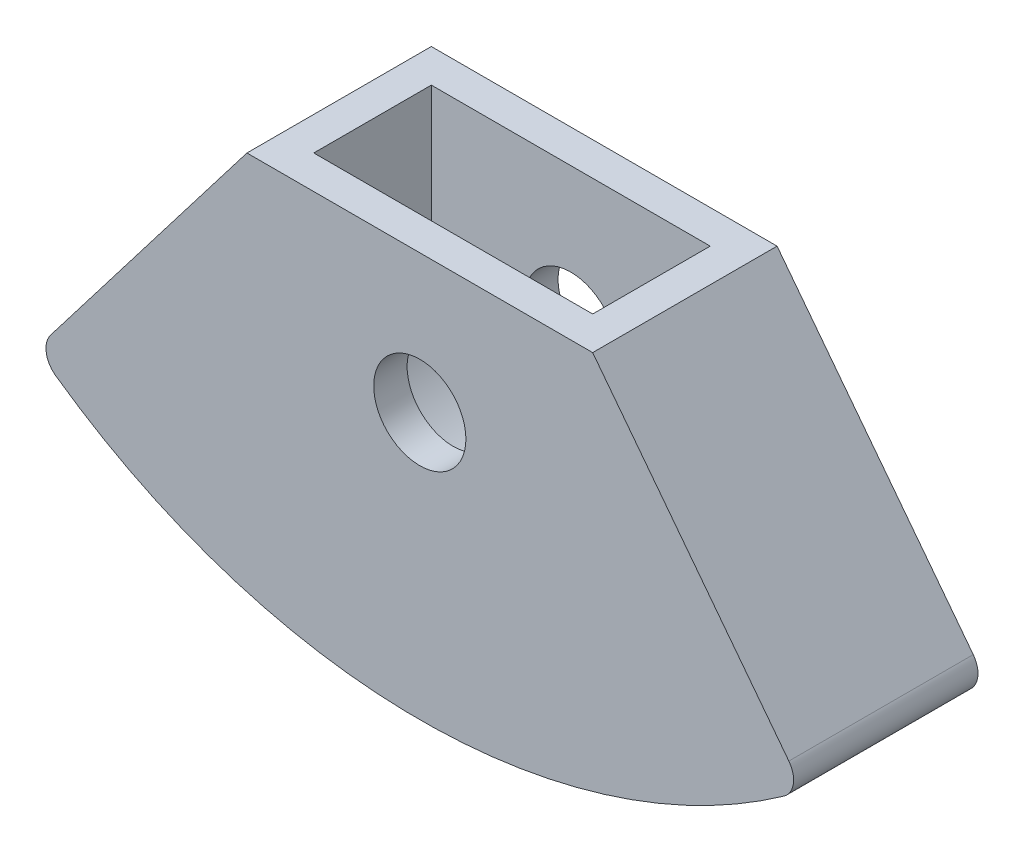
from build123d import *

# Parameters (mm, degrees)
EXTRUDE_1_DEPTH     = 4
CUT_EXTRUDE_1_DEPTH = 2.55
SKETCH_3_R          = 2
CUT_EXTRUDE_2_DEPTH = 31.567792564


with BuildPart() as part:
    # 草图1 → 凸台-拉伸1 (new, symmetric)
    with BuildSketch(Plane.XY):
        with BuildLine():
            Line((0, 0), (15, 0))
            Line((15, 0), (23.511091256, -11.091870075))
            ThreePointArc((23.511091256, -11.091870075), (23.706523759, -11.849971903), (23.295917311, -12.516541172))
            ThreePointArc((23.295917311, -12.516541172), (7.5, -17.545906941), (-8.295917311, -12.516541172))
            ThreePointArc((-8.295917311, -12.516541172), (-8.706523759, -11.849971903), (-8.511091256, -11.091870075))
            Line((-8.511091256, -11.091870075), (0, 0))
        make_face()
    extrude(amount=EXTRUDE_1_DEPTH, both=True)

    # 草图2 → 切除-拉伸1 (cut, symmetric)
    with BuildSketch(Plane.XY):
        with BuildLine():
            Line((1.45, 0), (1.45, -6))
            ThreePointArc((1.45, -6), (7.5, -12.05), (13.55, -6))
            Line((13.55, -6), (13.55, 0))
            Line((13.55, 0), (1.45, 0))
        make_face()
    extrude(amount=CUT_EXTRUDE_1_DEPTH, both=True, mode=Mode.SUBTRACT)

    # 草图3 → 切除-拉伸2 (cut, through all)
    with BuildSketch(Plane.XY.offset(4)):
        with Locations((7.5, -6)):
            Circle(SKETCH_3_R)
    extrude(amount=-CUT_EXTRUDE_2_DEPTH, mode=Mode.SUBTRACT)


solid = part.part
